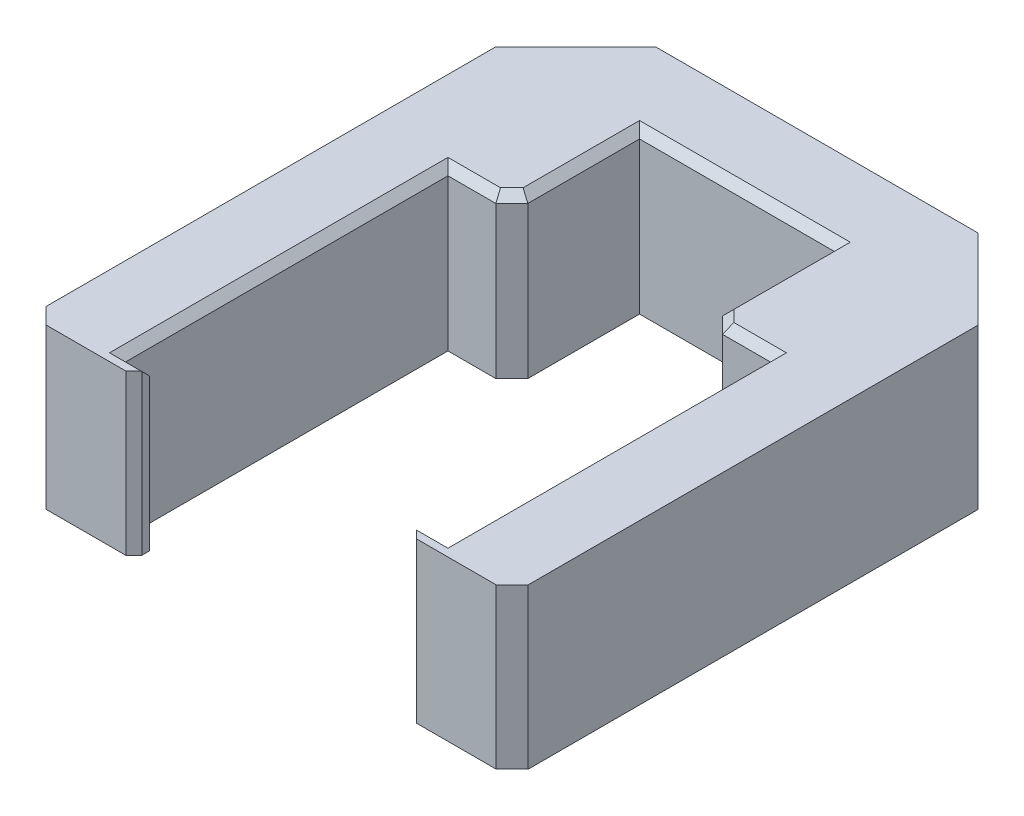
from build123d import *

# Parameters (mm, degrees)
BOSS_EXTRUDE1_DEPTH = 10
CHAMFER1_SIZE       = 5
CHAMFER3_SIZE       = 1
CHAMFER4_SIZE       = 0.5
CHAMFER5_SIZE       = 0.5


with BuildPart() as part:
    # Sketch1 → Boss-Extrude1 (new body)
    with BuildSketch(Plane(origin=(0, 0, 0), x_dir=(1, 0, 0), z_dir=(0, 1, 0))):
        Polygon((-0.1, 0), (-0.1, 20.1), (3.9, 20.1), (3.9, 28.1), (16.1, 28.1), (16.1, 20.1), (20.1, 20.1), (20.1, 0), (20.1, -0.1), (18.6, -0.1), (18.6, -1.076654702), (25.1, -1.076654702), (25.1, 10), (25.1, 33.1), (-5.1, 33.1), (-5.1, 10), (-5.1, -1.076654702), (1.4, -1.076654702), (1.4, -0.1), (-0.1, -0.1), align=None)
    extrude(amount=BOSS_EXTRUDE1_DEPTH)

    # Chamfer1
    chamfer1_edges = [part.edges().sort_by_distance(p)[0] for p in [
        (-5.1, 5, -33.1),
        (25.1, 5, -33.1),
    ]]
    chamfer(chamfer1_edges, length=CHAMFER1_SIZE)

    # Chamfer3
    chamfer3_edges = [part.edges().sort_by_distance(p)[0] for p in [
        (16.1, 5, -20.1),
        (3.9, 5, -20.1),
        (-5.1, 5, 1.076654702),
        (25.1, 5, 1.076654702),
    ]]
    chamfer(chamfer3_edges, length=CHAMFER3_SIZE)

    # Chamfer4
    chamfer4_edges = [part.edges().sort_by_distance(p)[0] for p in [
        (0.65, 10, 0.1),
        (-0.1, 10, -10),
        (1.4, 10, -20.1),
        (10, 10, -28.1),
        (3.9, 10, -24.6),
        (16.1, 10, -24.6),
        (18.6, 10, -20.1),
        (3.4, 10, -20.6),
        (16.6, 10, -20.6),
        (20.1, 10, -10.05),
        (19.35, 10, 0.1),
    ]]
    chamfer(chamfer4_edges, length=CHAMFER4_SIZE)

    # Chamfer5
    chamfer5_edges = [part.edges().sort_by_distance(p)[0] for p in [
        (18.6, 5, 1.076654702),
        (1.4, 5, 1.076654702),
    ]]
    chamfer(chamfer5_edges, length=CHAMFER5_SIZE)


solid = part.part
